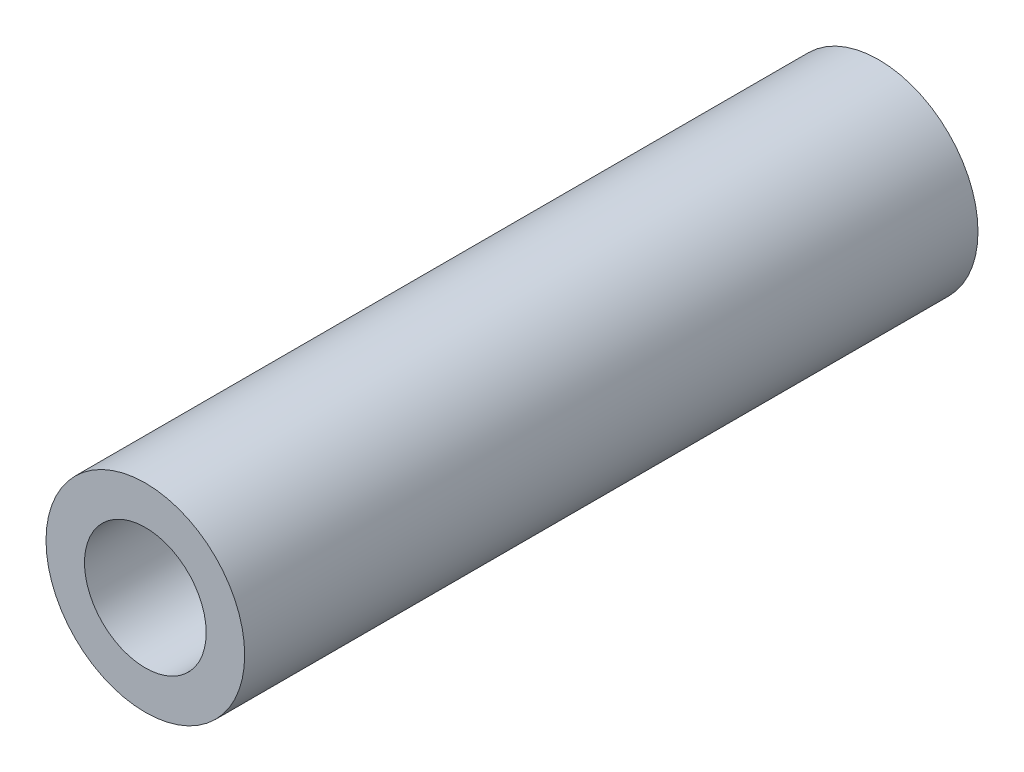
from build123d import *

# Parameters (mm, degrees)
SKETCH1_R           = 4.064
SKETCH1_R_2         = 2.4892
BOSS_EXTRUDE1_DEPTH = 15


with BuildPart() as part:
    # Sketch1 → Boss-Extrude1 (new, symmetric)
    with BuildSketch(Plane.XY):
        Circle(SKETCH1_R)
        Circle(SKETCH1_R_2, mode=Mode.SUBTRACT)
    extrude(amount=BOSS_EXTRUDE1_DEPTH, both=True)


solid = part.part
